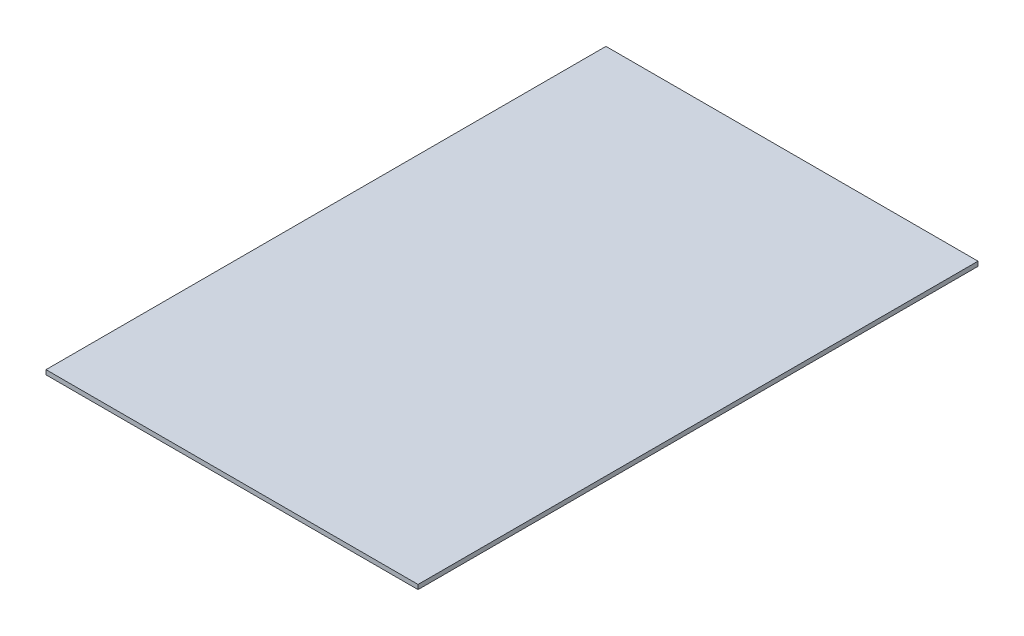
from build123d import *

# Parameters (mm, degrees)
SKETCH1_W           = 198
SKETCH1_H           = 298
BOSS_EXTRUDE1_DEPTH = 2.4


with BuildPart() as part:
    # Sketch1 → Boss-Extrude1 (new body)
    with BuildSketch(Plane(origin=(0, 0, 0), x_dir=(1, 0, 0), z_dir=(0, 1, 0))):
        Rectangle(SKETCH1_W, SKETCH1_H)
    extrude(amount=BOSS_EXTRUDE1_DEPTH)


solid = part.part
